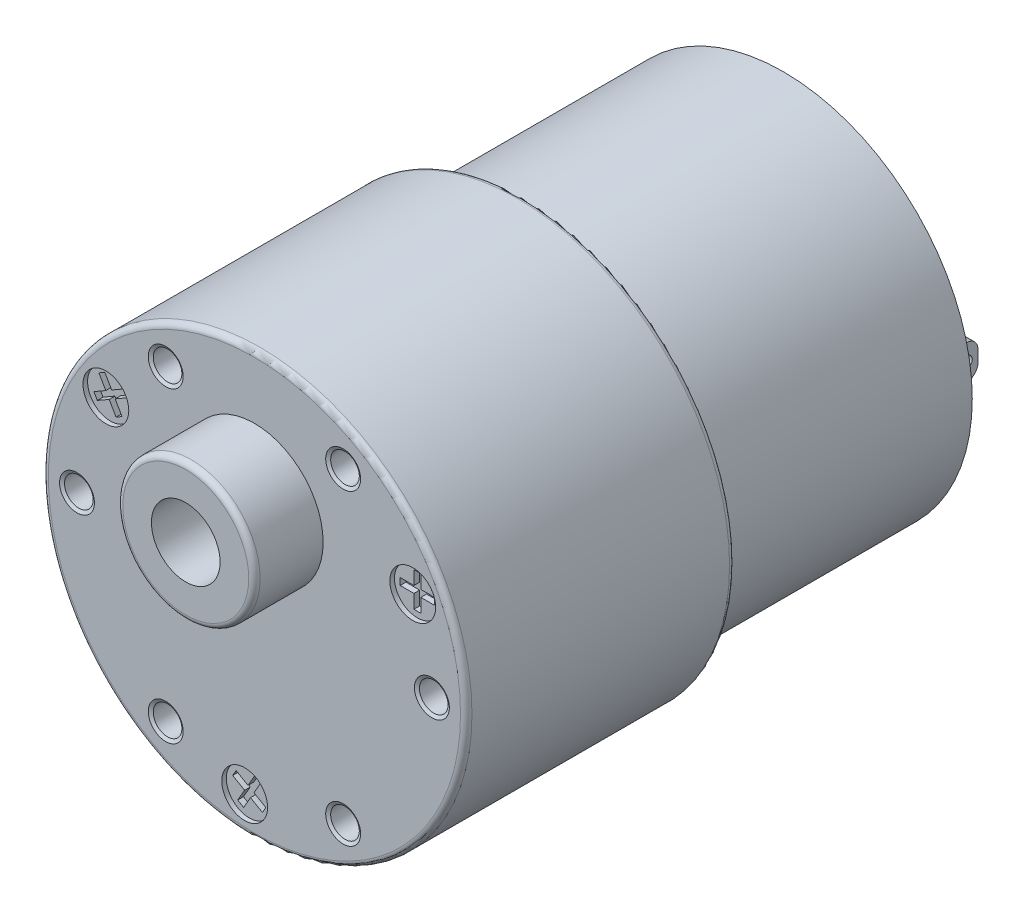
from build123d import *

# Parameters (mm, degrees)
SKETCH_1_R               = 16.5
EXTRUDE_1_DEPTH          = 22.7
SKETCH_2_R               = 18.5
EXTRUDE_2_DEPTH          = 23.5
SKETCH_3_R               = 6
EXTRUDE_3_DEPTH          = 6
SKETCH_4_R               = 3
EXTRUDE_4_DEPTH          = 15.5
CUT_EXTRUDE_START        = -12
CUT_EXTRUDE_1_DEPTH      = 12
SKETCH_6_W               = 1
SKETCH_6_H               = 3
EXTRUDE_5_DEPTH          = 3.5
SKETCH_7_R               = 1.5
EXTRUDE_6_DEPTH          = 1.5
SKETCH_8_R               = 0.5
CUT_EXTRUDE_2_DEPTH      = 78.133261308
FILLET_5_R               = 1
PATTERN_CIRCULAR_1_COUNT = 6
SKETCH_15_R              = 2
CUT_EXTRUDE_3_DEPTH      = 0.4
CUT_EXTRUDE_4_DEPTH      = 0.5
PATTERN_CIRCULAR_2_COUNT = 3
FILLET_6_R               = 0.5
SKETCH_18_R              = 16
CUT_EXTRUDE_5_DEPTH      = 0.6
FILLET_7_R               = 0.2
CHAMFER_1_SIZE           = 0.3
CROQUIS1_R               = 3
CORTAR_EXTRUIR1_DEPTH    = 22


with BuildPart() as part:
    # 草图1 → 凸台-拉伸1 (new body)
    with BuildSketch(Plane.XY):
        Circle(SKETCH_1_R)
    extrude(amount=EXTRUDE_1_DEPTH)

    # 草图2 → 凸台-拉伸2 (add)
    with BuildSketch(Plane.XY.offset(22.7)):
        Circle(SKETCH_2_R)
    extrude(amount=EXTRUDE_2_DEPTH)

    # 草图3 → 凸台-拉伸3 (add)
    with BuildSketch(Plane.XY.offset(46.2)):
        with Locations((0, 7)):
            Circle(SKETCH_3_R)
    extrude(amount=EXTRUDE_3_DEPTH)

    # 草图4 → 凸台-拉伸4 (add)
    with BuildSketch(Plane.XY.offset(52.2)):
        with Locations((0, 7)):
            Circle(SKETCH_4_R)
    extrude(amount=EXTRUDE_4_DEPTH)

    # 草图5 → 切除-拉伸1 (cut)
    with BuildSketch(Plane.XY.offset(67.7).offset(CUT_EXTRUDE_START)):
        with BuildLine():
            Line((-1.658312395, 9.5), (1.658312395, 9.5))
            ThreePointArc((1.658312395, 9.5), (0, 10), (-1.658312395, 9.5))
        make_face()
    extrude(amount=CUT_EXTRUDE_1_DEPTH, mode=Mode.SUBTRACT)

    # 草图6 → 凸台-拉伸5 (add)
    with BuildSketch(Plane(origin=(0, 0, 0), x_dir=(-1, 0, 0), z_dir=(0, 0, -1))):
        with Locations((-13, 0)):
            Rectangle(SKETCH_6_W, SKETCH_6_H)
        with Locations((13, 0)):
            Rectangle(SKETCH_6_W, SKETCH_6_H)
    extrude(amount=EXTRUDE_5_DEPTH)

    # 草图7 → 凸台-拉伸6 (add)
    with BuildSketch(Plane(origin=(0, 0, 0), x_dir=(-1, 0, 0), z_dir=(0, 0, -1))):
        Circle(SKETCH_7_R)
    extrude(amount=EXTRUDE_6_DEPTH)

    # 草图8 → 切除-拉伸2 (cut, through all)
    with BuildSketch(Plane(origin=(13.5, 0, 0), x_dir=(0, 0, -1), z_dir=(1, 0, 0))):
        with Locations((2.5, 0)):
            Circle(SKETCH_8_R)
    extrude(amount=-CUT_EXTRUDE_2_DEPTH, mode=Mode.SUBTRACT)

    # 圆角5
    fillet_5_edges = [part.edges().sort_by_distance(p)[0] for p in [
        (-13, 1.5, -3.5),
        (-13, -1.5, -3.5),
        (13, 1.5, -3.5),
        (13, -1.5, -3.5),
    ]]
    fillet(fillet_5_edges, radius=FILLET_5_R)

    # 草图13 → M3 螺纹孔3 (revolve, cut)
    with BuildSketch(Plane(origin=(7.75, 13.423393759, 46.2), x_dir=(0, -1, 0), z_dir=(1, 0, 0))):
        Polygon((0, 0), (0, 7.251075774), (1.25, 6.5), (1.25, 0.158771324), (1.525, 0), align=None)
    hole_wizard_m3_3 = revolve(axis=Axis((7.75, 13.423393759, 52.55), (0, 0, -1)), mode=Mode.SUBTRACT)

    # 阵列(圆周)1: M3 螺纹孔3 ×6 about axis
    pattern_circular_1_axis = Axis((0, 0, -7.35), (0, 0, 1))
    for i in range(1, PATTERN_CIRCULAR_1_COUNT):
        add(hole_wizard_m3_3.rotate(pattern_circular_1_axis, i * 360 / PATTERN_CIRCULAR_1_COUNT), mode=Mode.SUBTRACT)

    # 草图15 → 切除-拉伸3 (cut)
    with BuildSketch(Plane.XY.offset(46.2)):
        with Locations((13.829316686, 7)):
            Circle(SKETCH_15_R)
    cut_extrude_3 = extrude(amount=-CUT_EXTRUDE_3_DEPTH, mode=Mode.SUBTRACT)

    # 草图17 → 切除-拉伸4 (cut)
    with BuildSketch(Plane.XY.offset(45.8)):
        Polygon((13.529316686, 5.5), (13.529316686, 6.7), (12.329316686, 6.7), (12.329316686, 7.3), (13.529316686, 7.3), (13.529316686, 8.5), (14.129316686, 8.5), (14.129316686, 7.3), (15.329316686, 7.3), (15.329316686, 6.7), (14.129316686, 6.7), (14.129316686, 5.5), align=None)
    cut_extrude_4 = extrude(amount=-CUT_EXTRUDE_4_DEPTH, mode=Mode.SUBTRACT)

    # 阵列(圆周)2: 切除-拉伸3, 切除-拉伸4 ×3 about axis
    pattern_circular_2_axis = Axis((0, 0, -7.35), (0, 0, 1))
    add([cut_extrude_3.rotate(pattern_circular_2_axis, i * 360 / PATTERN_CIRCULAR_2_COUNT) for i in range(1, PATTERN_CIRCULAR_2_COUNT)], mode=Mode.SUBTRACT)
    add([cut_extrude_4.rotate(pattern_circular_2_axis, i * 360 / PATTERN_CIRCULAR_2_COUNT) for i in range(1, PATTERN_CIRCULAR_2_COUNT)], mode=Mode.SUBTRACT)

    # 圆角6
    fillet_6_edges = [part.edges().sort_by_distance(p)[0] for p in [
        (-6, 7, 52.2),
        (-18.5, 0, 46.2),
        (-18.5, 0, 22.7),
    ]]
    fillet(fillet_6_edges, radius=FILLET_6_R)

    # 草图18 → 切除-拉伸5 (cut)
    with BuildSketch(Plane(origin=(0, 0, 0), x_dir=(-1, 0, 0), z_dir=(0, 0, -1))):
        Circle(SKETCH_18_R)
    extrude(amount=-CUT_EXTRUDE_5_DEPTH, mode=Mode.SUBTRACT)


with BuildPart() as cut_extrude_5_piece_1:
    # of the separate pieces the step leaves, piece 1, a body of its own (cut_extrude_5_pieces)
    add(part.part.solids().sort_by_distance((18, 0, 22.7))[0])

    # 倒角1
    chamfer_1_edges = [cut_extrude_5_piece_1.edges().sort_by_distance(p)[0] for p in [
        (0, 9.5, 67.7),
        (-1.418637165, 4.356617963, 67.7),
    ]]
    chamfer(chamfer_1_edges, length=CHAMFER_1_SIZE)

    # Croquis1 → Cortar-Extruir1 (cut)
    with BuildSketch(Plane.XY.offset(67.7)):
        with Locations((0, 7)):
            Circle(CROQUIS1_R)
    extrude(amount=-CORTAR_EXTRUIR1_DEPTH, mode=Mode.SUBTRACT)


with BuildPart() as cut_extrude_5_piece_2:
    # of the separate pieces the step leaves, piece 2, a body of its own (cut_extrude_5_pieces)
    add(part.part.solids().sort_by_distance((-1.5, 0, 0))[0])

    # 圆角7
    fillet_7_edges = [cut_extrude_5_piece_2.edges().sort_by_distance(p)[0] for p in [
        (1.5, 0, -1.5),
    ]]
    fillet(fillet_7_edges, radius=FILLET_7_R)


with BuildPart() as cut_extrude_5_piece_3:
    # of the separate pieces the step leaves, piece 3, a body of its own (cut_extrude_5_pieces)
    add(part.part.solids().sort_by_distance((13.5, 1.5, -2.5))[0])


with BuildPart() as cut_extrude_5_piece_4:
    # of the separate pieces the step leaves, piece 4, a body of its own (cut_extrude_5_pieces)
    add(part.part.solids().sort_by_distance((-13.5, 1.5, -2.5))[0])


solid = Compound([cut_extrude_5_piece_1.part, cut_extrude_5_piece_2.part, cut_extrude_5_piece_3.part, cut_extrude_5_piece_4.part])
